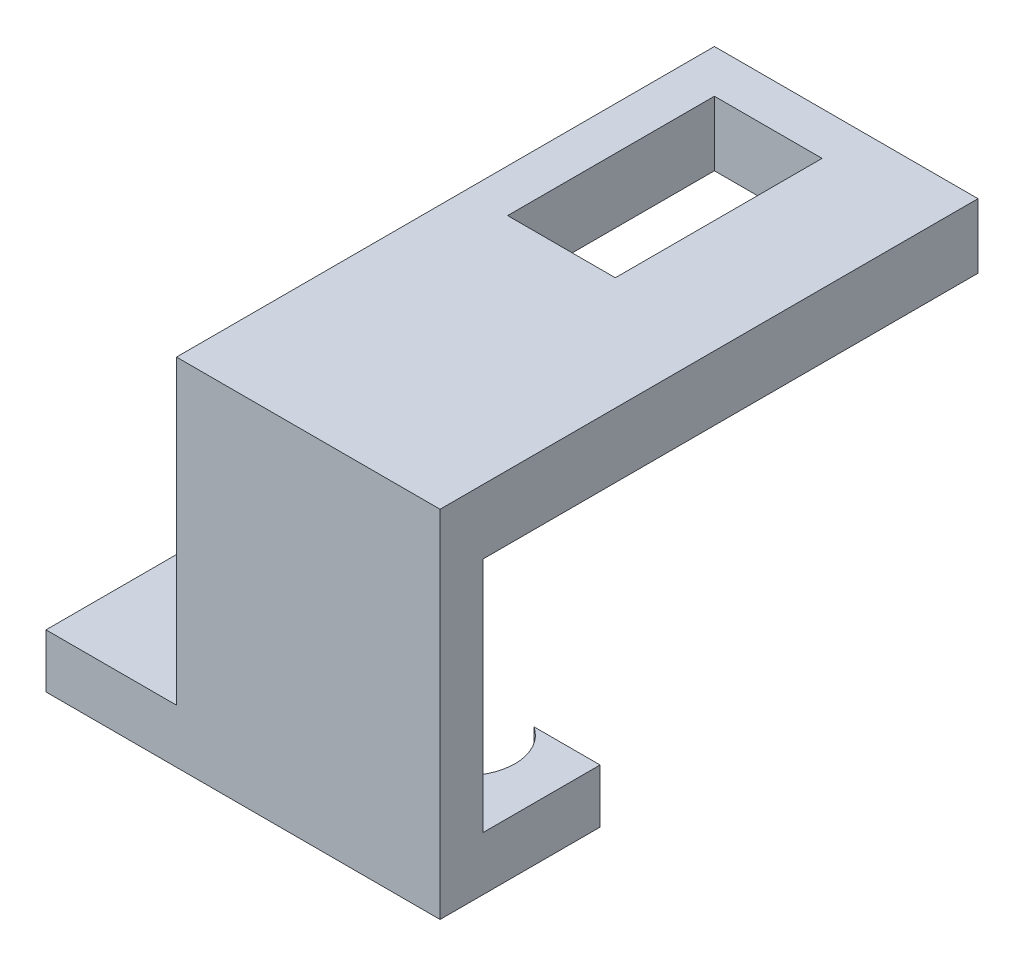
from build123d import *

# Parameters (mm, degrees)
BOSS_EXTRUDE1_DEPTH = 2.5
SKETCH2_W           = 18.3
SKETCH2_H           = 2
BOSS_EXTRUDE2_DEPTH = 14
SKETCH3_W           = 18.3
SKETCH3_H           = 3
BOSS_EXTRUDE3_DEPTH = 22.98
SKETCH4_W           = 5
SKETCH4_H           = 9.60227247
SKETCH4_W_2         = 6.06
SKETCH4_H_2         = 22.98
CUT_EXTRUDE1_DEPTH  = 3
SKETCH5_W           = 6.06
SKETCH5_H           = 14
CUT_EXTRUDE2_DEPTH  = 2


with BuildPart() as part:
    # Sketch1 → Boss-Extrude1 (new body)
    with BuildSketch(Plane(origin=(0, 0, 0), x_dir=(1, 0, 0), z_dir=(0, 1, 0))):
        with BuildLine():
            Line((-9.15, -3.5), (-9.15, 1.930673458))
            Line((-9.15, 1.930673458), (-6.075, 1.930673458))
            ThreePointArc((-6.075, 1.930673458), (-4.825, -2.3), (-3.575, 1.930673458))
            Line((-3.575, 1.930673458), (-0.575, 1.930673458))
            Line((-0.575, 1.930673458), (-0.575, -2.281126238))
            Line((-0.575, -2.281126238), (0.575, -2.281126238))
            Line((0.575, -2.281126238), (0.575, 1.930673458))
            Line((0.575, 1.930673458), (3.575, 1.930673458))
            ThreePointArc((3.575, 1.930673458), (4.825, -2.3), (6.075, 1.930673458))
            Line((6.075, 1.930673458), (9.15, 1.930673458))
            Line((9.15, 1.930673458), (9.15, -3.5))
            Line((9.15, -3.5), (9.15, -5.5))
            Line((9.15, -5.5), (-9.15, -5.5))
            Line((-9.15, -5.5), (-9.15, -3.5))
        make_face()
    extrude(amount=BOSS_EXTRUDE1_DEPTH)

    # Sketch2 → Boss-Extrude2 (add)
    with BuildSketch(Plane(origin=(0, 2.5, 0), x_dir=(1, 0, 0), z_dir=(0, 1, 0))):
        with Locations((0, -4.5)):
            Rectangle(SKETCH2_W, SKETCH2_H)
    extrude(amount=BOSS_EXTRUDE2_DEPTH)

    # Sketch3 → Boss-Extrude3 (add)
    with BuildSketch(Plane(origin=(0, 0, 3.5), x_dir=(-1, 0, 0), z_dir=(0, 0, -1))):
        with Locations((0, 15)):
            Rectangle(SKETCH3_W, SKETCH3_H)
    extrude(amount=BOSS_EXTRUDE3_DEPTH)

    # Sketch4 → Cut-Extrude1 (cut)
    with BuildSketch(Plane(origin=(0, 16.5, 0), x_dir=(1, 0, 0), z_dir=(0, 1, 0))):
        with Locations((1.41, 12.678863765)):
            Rectangle(SKETCH4_W, SKETCH4_H)
        with Locations((-6.12, 7.99)):
            Rectangle(SKETCH4_W_2, SKETCH4_H_2)
    extrude(amount=-CUT_EXTRUDE1_DEPTH, mode=Mode.SUBTRACT)

    # Sketch5 → Cut-Extrude2 (cut)
    with BuildSketch(Plane.XY.offset(5.5)):
        with Locations((-6.12, 9.5)):
            Rectangle(SKETCH5_W, SKETCH5_H)
    extrude(amount=-CUT_EXTRUDE2_DEPTH, mode=Mode.SUBTRACT)


solid = part.part
